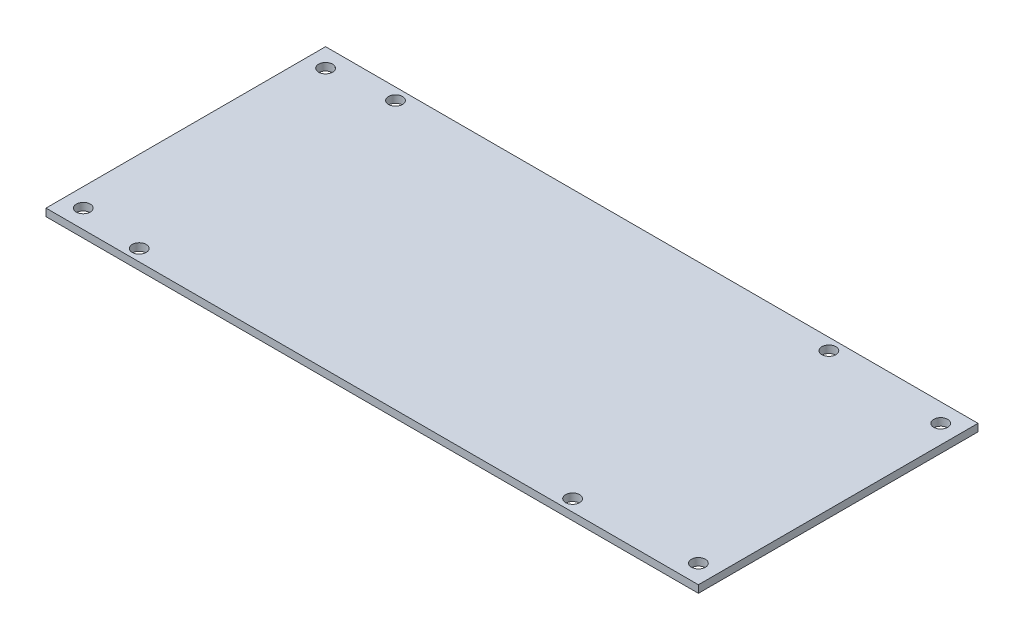
from build123d import *

# Parameters (mm, degrees)
SKETCH_1_W          = 140
SKETCH_1_H          = 60
EXTRUDE_1_DEPTH     = 1.6
SKETCH_2_R          = 1.5
CUT_EXTRUDE_1_DEPTH = 1.6
SKETCH_3_R          = 1.5
CUT_EXTRUDE_2_DEPTH = 1.6


with BuildPart() as part:
    # Эскиз1 → Бобышка-Вытянуть1 (new body)
    with BuildSketch(Plane(origin=(0, 0, 0), x_dir=(1, 0, 0), z_dir=(0, 1, 0))):
        Rectangle(SKETCH_1_W, SKETCH_1_H)
    extrude(amount=EXTRUDE_1_DEPTH)

    # Эскиз2 → Вырез-Вытянуть1 (cut)
    with BuildSketch(Plane(origin=(0, 1.6, 0), x_dir=(1, 0, 0), z_dir=(0, 1, 0))):
        with Locations(Location((-66, 26, 0), (0, 0, 270))):
            Circle(SKETCH_2_R)
        with Locations(Location((-66, -26, 0), (0, 0, 270))):
            Circle(SKETCH_2_R)
        with Locations(Location((66, -26, 0), (0, 0, 270))):
            Circle(SKETCH_2_R)
        with Locations(Location((66, 26, 0), (0, 0, 270))):
            Circle(SKETCH_2_R)
    extrude(amount=-CUT_EXTRUDE_1_DEPTH, mode=Mode.SUBTRACT)

    # Эскиз3 → Вырез-Вытянуть2 (cut)
    with BuildSketch(Plane(origin=(0, 1.6, 0), x_dir=(1, 0, 0), z_dir=(0, 1, 0))):
        with Locations(Location((-52.5, 27.5, 0), (0, 0, 270))):
            Circle(SKETCH_3_R)
        with Locations(Location((-52.5, -27.5, 0), (0, 0, 270))):
            Circle(SKETCH_3_R)
        with Locations(Location((40.5, 27.5, 0), (0, 0, 270))):
            Circle(SKETCH_3_R)
        with Locations(Location((40.5, -27.5, 0), (0, 0, 270))):
            Circle(SKETCH_3_R)
    extrude(amount=-CUT_EXTRUDE_2_DEPTH, mode=Mode.SUBTRACT)


solid = part.part
